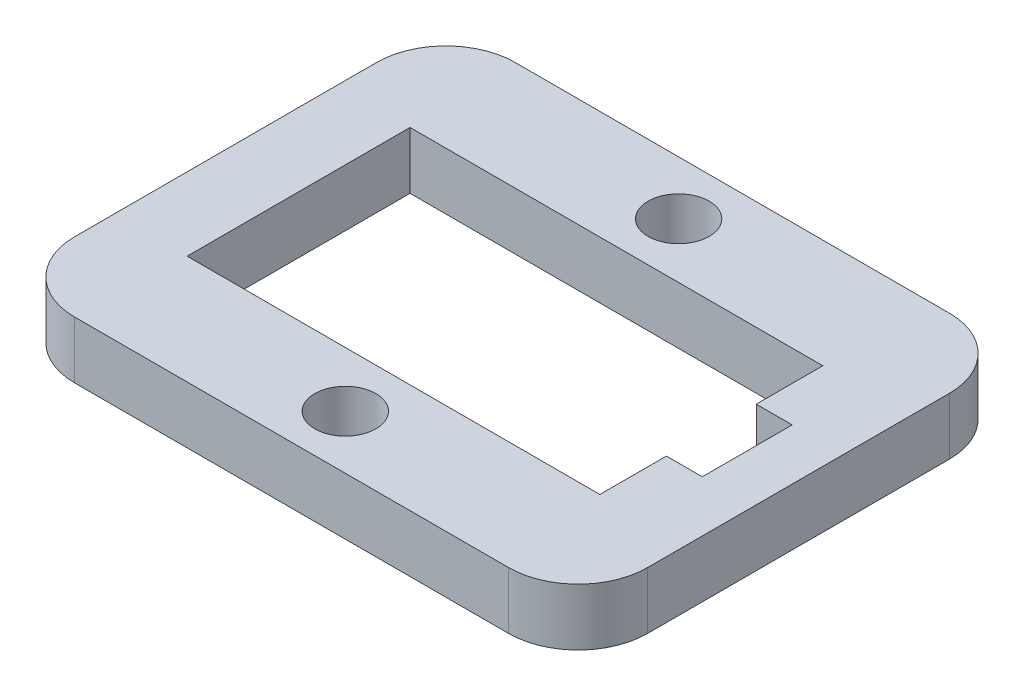
from build123d import *

# Parameters (mm, degrees)
SKETCH1_R           = 1.700000029
BOSS_EXTRUDE1_DEPTH = 3.175


with BuildPart() as part:
    # Sketch1 → Boss-Extrude1 (new body)
    with BuildSketch(Plane(origin=(0, 0, 0), x_dir=(1, 0, 0), z_dir=(0, 1, 0))):
        with BuildLine():
            Line((-1.425196706, 15.763070025), (-25.583614521, 15.763070025))
            ThreePointArc((-25.583614521, 15.763070025), (-28.310130326, 14.633710201), (-29.439490151, 11.907194396))
            Line((-29.439490151, 11.907194396), (-29.439490151, -4.88887146))
            ThreePointArc((-29.439490151, -4.88887146), (-28.308084251, -7.620326926), (-25.576628785, -8.751732825))
            Line((-25.576628785, -8.751732825), (-1.432182442, -8.751732825))
            ThreePointArc((-1.432182442, -8.751732825), (1.299273025, -7.620326926), (2.430678924, -4.88887146))
            Line((2.430678924, -4.88887146), (2.430678924, 11.907194396))
            ThreePointArc((2.430678924, 11.907194396), (1.301319099, 14.633710201), (-1.425196706, 15.763070025))
        make_face()
        with Locations(Location((-13.507869129, 12.77916147, 0), (0, 0, 270))):
            Circle(SKETCH1_R, mode=Mode.SUBTRACT)
        with Locations(Location((-13.507869129, -5.760838534, 0), (0, 0, 270))):
            Circle(SKETCH1_R, mode=Mode.SUBTRACT)
        Polygon((-2.416750389, 9.709339568), (-25.375916231, 9.709339568), (-25.375916231, -2.691010202), (-2.416750389, -2.691010202), (-2.416750389, 1.009089439), (-0.420102398, 1.009089439), (-0.420102398, 6.009239927), (-2.416750389, 6.009239927), align=None, mode=Mode.SUBTRACT)
    extrude(amount=BOSS_EXTRUDE1_DEPTH)


solid = part.part
